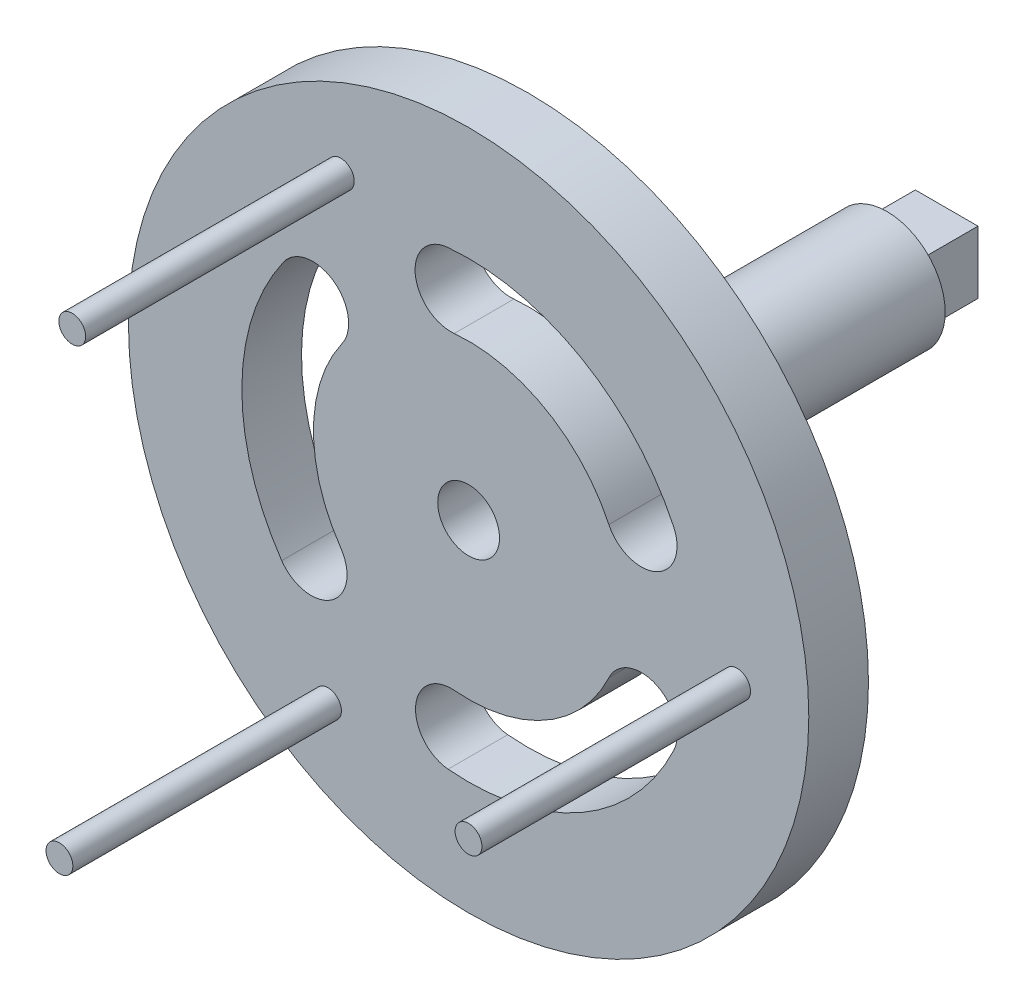
from build123d import *
from build123d.topology import SkipClean

# Parameters (mm, degrees)
SKETCH1_R           = 57
SKETCH1_R_2         = 5.175
BOSS_EXTRUDE1_DEPTH = 10
SKETCH3_R           = 2.25
BOSS_EXTRUDE2_DEPTH = 45
BOSS_EXTRUDE3_START = 60.1
SKETCH4_R           = 9.75
SKETCH4_R_2         = 5.175
BOSS_EXTRUDE3_DEPTH = 60.1
SKETCH5_W           = 10.5
SKETCH5_H           = 10.5
BOSS_EXTRUDE4_DEPTH = 10
CUT_EXTRUDE1_DEPTH  = 10
CIRPATTERN1_COUNT   = 3


with BuildPart() as part:
    # Sketch1 → Boss-Extrude1 (new body)
    with BuildSketch(Plane(origin=(0, 0, 0), x_dir=(0, 1, 0), z_dir=(0, 0, 1))):
        Circle(SKETCH1_R)
        Circle(SKETCH1_R_2, mode=Mode.SUBTRACT)
    extrude(amount=BOSS_EXTRUDE1_DEPTH)

    # Sketch3 → Boss-Extrude2 (add)
    with BuildSketch(Plane.XY.offset(10)):
        with Locations((-21.418860984, 39.575654059)):
            Circle(SKETCH3_R)
    boss_extrude2 = extrude(amount=BOSS_EXTRUDE2_DEPTH)

    # Sketch4 → Boss-Extrude3 (add)
    with SkipClean():  # the faces are left unmerged after this step: merging them gives an invalid solid
        with BuildSketch(Plane(origin=(0, 0, 0), x_dir=(-1, 0, 0), z_dir=(0, 0, -1)).offset(BOSS_EXTRUDE3_START)):
            Circle(SKETCH4_R)
            Circle(SKETCH4_R_2, mode=Mode.SUBTRACT)
        extrude(amount=-BOSS_EXTRUDE3_DEPTH)

    # Sketch5 → Boss-Extrude4 (add)
    with SkipClean():  # the faces are left unmerged after this step: merging them gives an invalid solid
        with BuildSketch(Plane(origin=(0, 0, -60.1), x_dir=(-1, 0, 0), z_dir=(0, 0, -1))):
            Rectangle(SKETCH5_W, SKETCH5_H)
        extrude(amount=BOSS_EXTRUDE4_DEPTH)

    # Sketch6 → Cut-Extrude1 (cut)
    with SkipClean():  # the faces are left unmerged after this step: merging them gives an invalid solid
        with BuildSketch(Plane(origin=(0, 0, 0), x_dir=(-1, 0, 0), z_dir=(0, 0, -1))):
            with BuildLine():
                ThreePointArc((-23.526269879, -11.068632508), (-31.509708891, -8.193793114), (-34.384548284, -16.177232126))
                ThreePointArc((-34.384548284, -16.177232126), (-18.887293866, -32.973779438), (3.441417522, -37.843845542))
                ThreePointArc((3.441417522, -37.843845542), (8.873379841, -31.325119796), (2.354654094, -25.893157476))
                ThreePointArc((2.354654094, -25.893157476), (-12.922885277, -22.561006984), (-23.526269879, -11.068632508))
            make_face()
            with BuildLine():
                ThreePointArc((2.41657911, 25.887451505), (8.948278483, 31.303806673), (3.531923315, 37.835506045))
                ThreePointArc((3.531923315, 37.835506045), (-18.808372522, 33.018860112), (-34.345756916, 16.259427476))
                ThreePointArc((-34.345756916, 16.259427476), (-31.490020689, 8.269135204), (-23.499728416, 11.124871431))
                ThreePointArc((-23.499728416, 11.124871431), (-12.868886462, 22.591851656), (2.41657911, 25.887451505))
            make_face()
            with BuildLine():
                ThreePointArc((21.430343191, -14.722105512), (22.978398041, -23.064978289), (31.321270818, -21.51692344))
                ThreePointArc((31.321270818, -21.51692344), (37.99899628, 0.276191416), (31.005191486, 21.969936298))
                ThreePointArc((31.005191486, 21.969936298), (22.640697625, 23.396555538), (21.214078385, 15.032061678))
                ThreePointArc((21.214078385, 15.032061678), (25.999313244, 0.188973074), (21.430343191, -14.722105512))
            make_face()
        extrude(amount=-CUT_EXTRUDE1_DEPTH, mode=Mode.SUBTRACT)

    # CirPattern1: Boss-Extrude2 ×3 about axis
    with SkipClean():  # the faces are left unmerged after this step: merging them gives an invalid solid
        cirpattern1_axis = Axis((0, 0, -60.1), (0, 0, 1))
        for i in range(1, CIRPATTERN1_COUNT):
            add(boss_extrude2.rotate(cirpattern1_axis, i * 360 / CIRPATTERN1_COUNT))


solid = part.part
